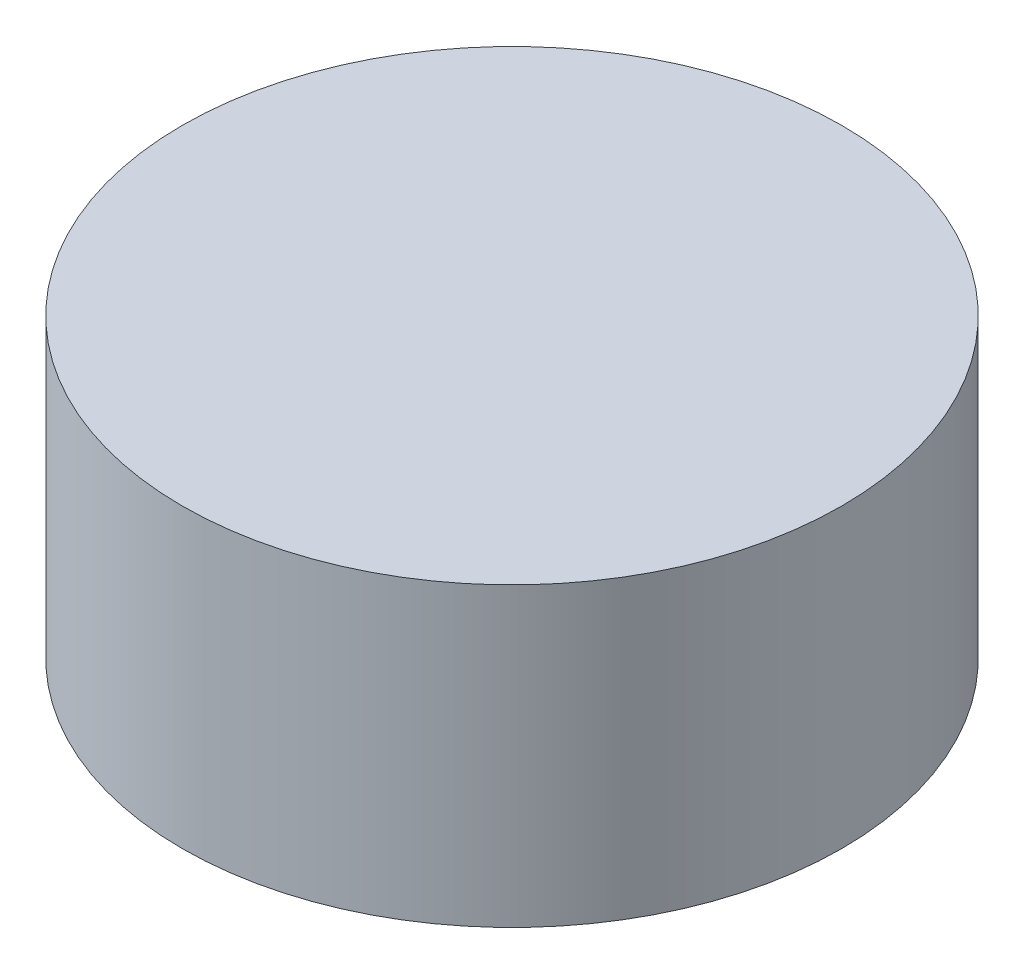
from build123d import *

# Parameters (mm, degrees)
SKETCH1_R           = 25.4
BOSS_EXTRUDE1_DEPTH = 22.86


with BuildPart() as part:
    # Sketch1 → Boss-Extrude1 (new body)
    with BuildSketch(Plane(origin=(0, 0, 0), x_dir=(1, 0, 0), z_dir=(0, 1, 0))):
        Circle(SKETCH1_R)
    extrude(amount=BOSS_EXTRUDE1_DEPTH)


solid = part.part
